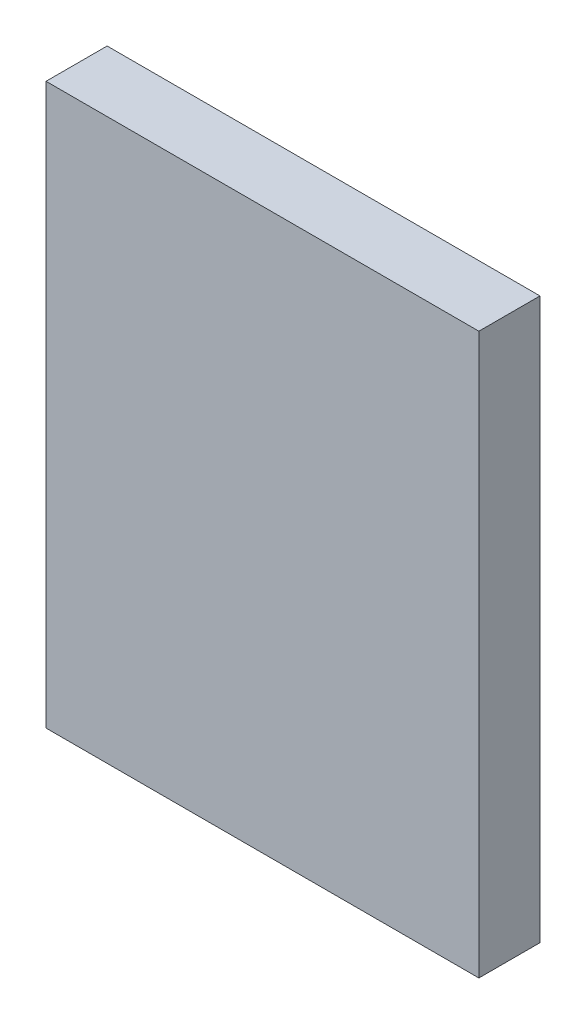
from build123d import *

# Parameters (mm, degrees)
SKETCH1_W           = 17
SKETCH1_H           = 22
BOSS_EXTRUDE1_DEPTH = 2.4


with BuildPart() as part:
    # Sketch1 → Boss-Extrude1 (new body)
    with BuildSketch(Plane.XY):
        with Locations((8.5, 11)):
            Rectangle(SKETCH1_W, SKETCH1_H)
    extrude(amount=BOSS_EXTRUDE1_DEPTH)


solid = part.part
